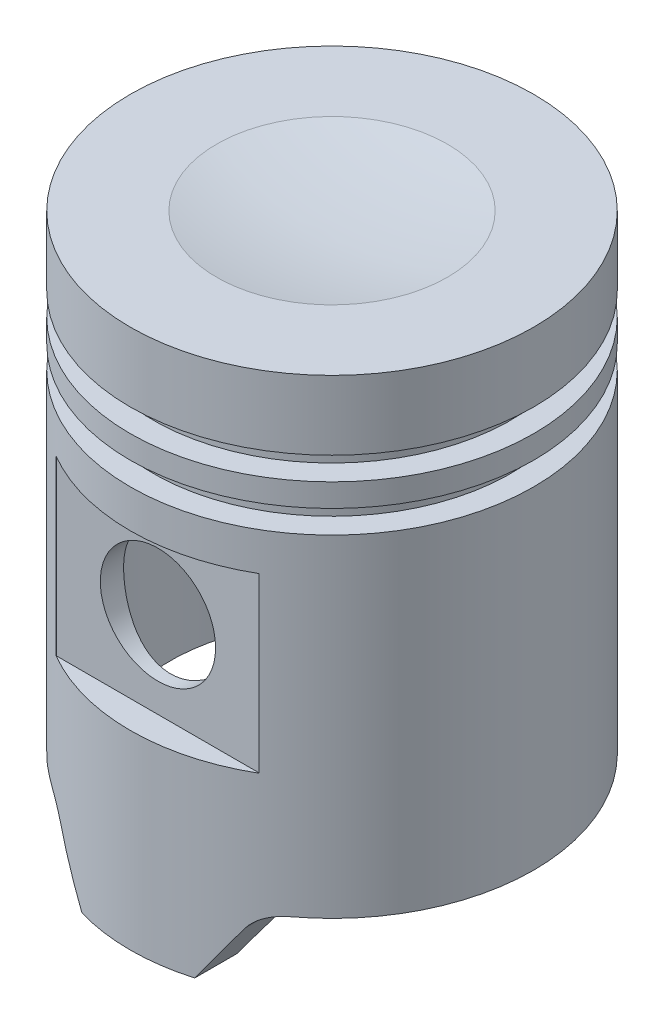
from build123d import *

# Parameters (mm, degrees)
SKETCH2_R            = 6.35
CUT_EXTRUDE2_DEPTH   = 72.795898079
SKETCH2_4_W          = 22.352
SKETCH2_4_H          = 19.05
SKETCH2_4_R          = 6.35
CUT_EXTRUDE3_DEPTH   = 3.048
SKETCH3_R            = 17.78
CUT_EXTRUDE4_DEPTH   = 36.576
BOSS_EXTRUDE1_START  = 7.62
BOSS_EXTRUDE1_DEPTH  = 7.62
CUT_EXTRUDE5_DEPTH   = 12.7
MIRROR3_COPY_1_DEPTH = 12.7


with BuildPart() as part:
    # Sketch1 → Revolve1 (revolve)
    with BuildSketch(Plane.XY):
        with BuildLine():
            Line((0, 0), (0, 50.546))
            ThreePointArc((0, 50.546), (6.387986381, 50.864288237), (12.712693656, 51.816))
            Line((12.712693656, 51.816), (22.225, 51.816))
            Line((22.225, 51.816), (22.225, 44.196))
            Line((22.225, 44.196), (19.685, 44.196))
            Line((19.685, 44.196), (19.685, 41.656))
            Line((19.685, 41.656), (22.225, 41.656))
            Line((22.225, 41.656), (22.225, 39.116))
            Line((22.225, 39.116), (19.685, 39.116))
            Line((19.685, 39.116), (19.685, 36.576))
            Line((19.685, 36.576), (22.225, 36.576))
            Line((22.225, 36.576), (22.225, 0))
            Line((22.225, 0), (0, 0))
        make_face()
    revolve(axis=Axis((0, 0, 0), (0, 1, 0)))

    # Sketch2 → Cut-Extrude2 (cut, through all)
    with BuildSketch(Plane.XY.offset(22.225)):
        with Locations((0, 22.86)):
            Circle(SKETCH2_R)
    extrude(amount=-CUT_EXTRUDE2_DEPTH, mode=Mode.SUBTRACT)

    # Sketch2<4> → Cut-Extrude3 (cut)
    with BuildSketch(Plane.XY.offset(22.225)):
        with Locations((0, 22.86)):
            Rectangle(SKETCH2_4_W, SKETCH2_4_H)
        with Locations((0, 22.86)):
            Circle(SKETCH2_4_R, mode=Mode.SUBTRACT)
    cut_extrude3 = extrude(amount=-CUT_EXTRUDE3_DEPTH, mode=Mode.SUBTRACT)

    # Mirror1: Cut-Extrude3 across plane
    add(cut_extrude3.mirror(Plane.XY), mode=Mode.SUBTRACT)

    # Sketch3 → Cut-Extrude4 (cut)
    with BuildSketch(Plane.XZ):
        Circle(SKETCH3_R)
    extrude(amount=-CUT_EXTRUDE4_DEPTH, mode=Mode.SUBTRACT)

    # Sketch4 → Boss-Extrude1 (add)
    with BuildSketch(Plane.XZ.offset(BOSS_EXTRUDE1_START)):
        with BuildLine():
            Line((-13.335, 17.78), (-13.335, 11.760364578))
            ThreePointArc((-13.335, 11.760364578), (0, 17.78), (13.335, 11.760364578))
            Line((13.335, 11.760364578), (13.335, 17.78))
            ThreePointArc((13.335, 17.78), (0, 22.225), (-13.335, 17.78))
        make_face()
    boss_extrude1 = extrude(amount=-BOSS_EXTRUDE1_DEPTH)

    # Sketch5 → Cut-Extrude5 (cut)
    with BuildSketch(Plane.XY.offset(22.225)):
        with BuildLine():
            Line((-6.215335004, -7.62), (-10.207026408, -1.634711235))
            ThreePointArc((-10.207026408, -1.634711235), (-11.57031167, -0.433318923), (-13.335, 0))
            Line((-13.335, 0), (-13.335, -7.62))
            Line((-13.335, -7.62), (-6.215335004, -7.62))
        make_face()
    cut_extrude5 = extrude(amount=-CUT_EXTRUDE5_DEPTH, mode=Mode.SUBTRACT)

    # Mirror2: Cut-Extrude5 across plane
    add(cut_extrude5.mirror(Plane(origin=(0, 0, 0), x_dir=(0, 0, 1), z_dir=(1, 0, 0))), mode=Mode.SUBTRACT)

    # Mirror3: Boss-Extrude1, Cut-Extrude5 across plane
    add(boss_extrude1.mirror(Plane.XY))
    add(cut_extrude5.mirror(Plane.XY), mode=Mode.SUBTRACT)

    # Mirror3 copy 1 sketch → Mirror3 copy 1 (cut)
    with BuildSketch(Plane(origin=(0, 0, -22.225), x_dir=(-1, 0, 0), z_dir=(0, 0, -1))):
        with BuildLine():
            Line((-6.215335004, -7.62), (-10.207026408, -1.634711235))
            ThreePointArc((-10.207026408, -1.634711235), (-11.57031167, -0.433318923), (-13.335, 0))
            Line((-13.335, 0), (-13.335, -7.62))
            Line((-13.335, -7.62), (-6.215335004, -7.62))
        make_face()
    extrude(amount=-MIRROR3_COPY_1_DEPTH, mode=Mode.SUBTRACT)


solid = part.part
